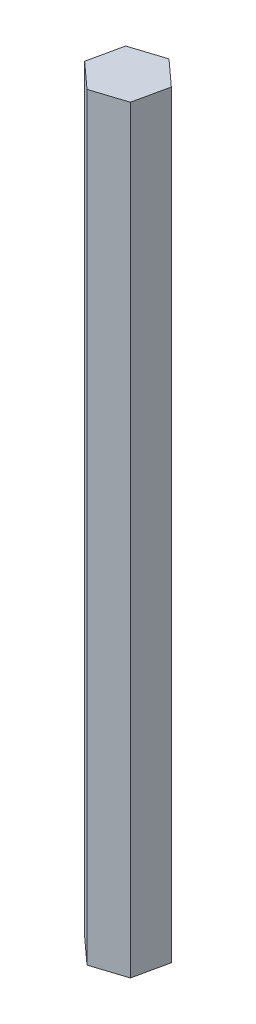
from build123d import *

# Parameters (mm, degrees)
BOSS_EXTRUDE1_DEPTH = 63.5


with BuildPart() as part:
    # Sketch2 → Boss-Extrude1 (new body)
    with BuildSketch(Plane(origin=(0, 0, 0), x_dir=(1, 0, 0), z_dir=(0, 1, 0))):
        Polygon((2.137295047, -1.940438924), (2.749116926, 0.880732344), (0.611821879, 2.821171268), (-2.137295047, 1.940438924), (-2.749116926, -0.880732344), (-0.611821879, -2.821171268), align=None)
    extrude(amount=BOSS_EXTRUDE1_DEPTH)


solid = part.part
